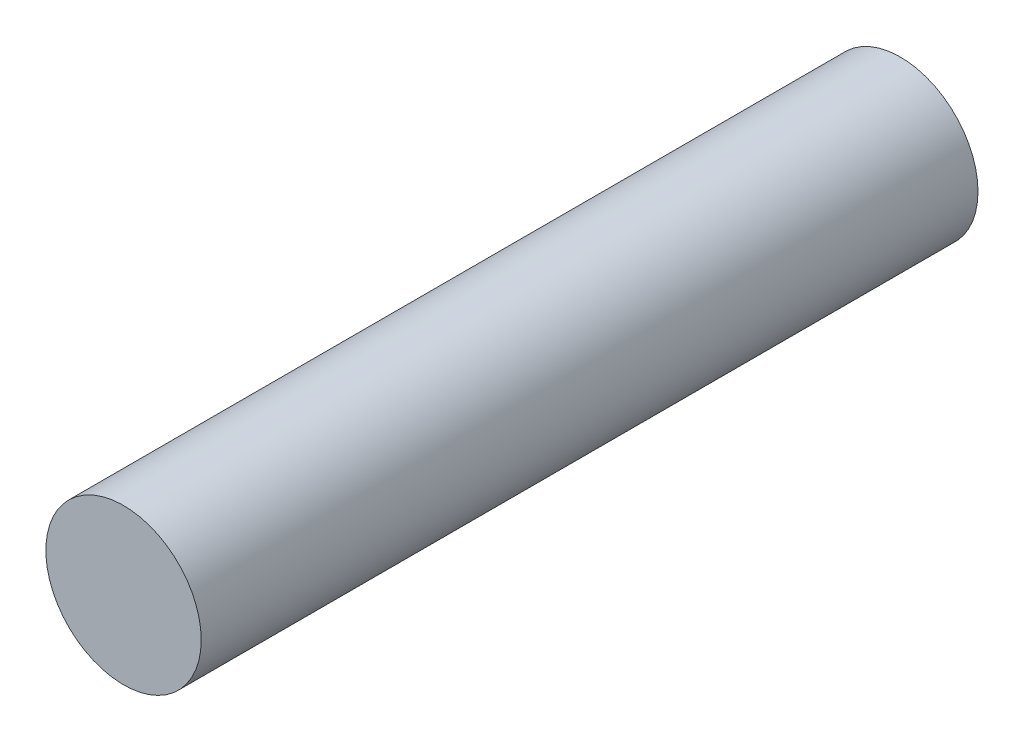
from build123d import *

# Parameters (mm, degrees)
CROQUIS1_R              = 5
SALIENTE_EXTRUIR2_DEPTH = 50


with BuildPart() as part:
    # Croquis1 → Saliente-Extruir2 (new body)
    with BuildSketch(Plane.XY):
        with Locations((-75.238692686, 16.536486949)):
            Circle(CROQUIS1_R)
    extrude(amount=SALIENTE_EXTRUIR2_DEPTH)


solid = part.part
